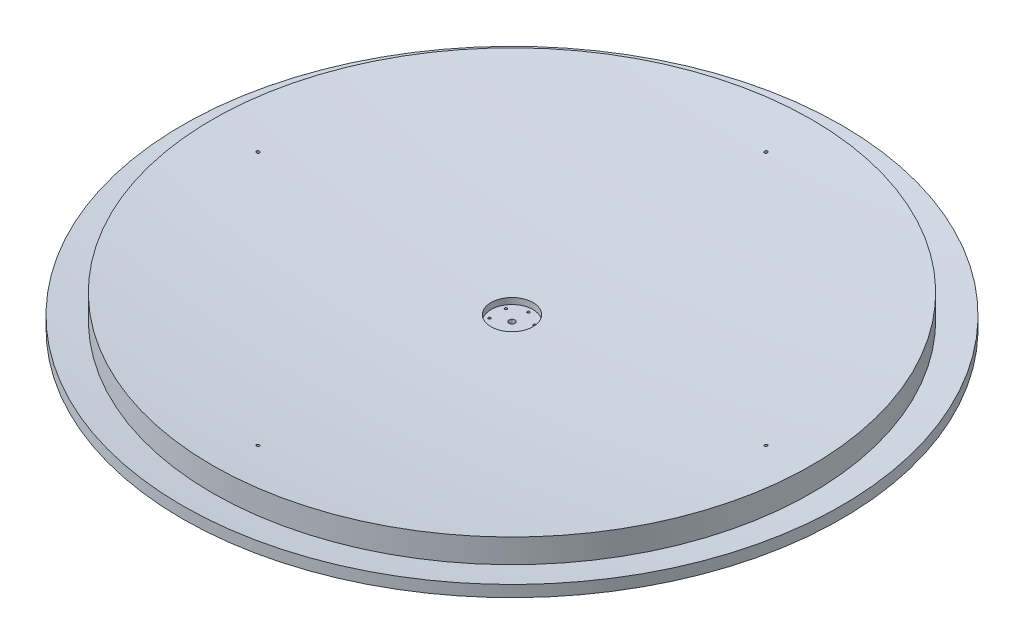
from build123d import *

# Parameters (mm, degrees)
HOLE_WIZARD_M51_D               = 4.2
HOLE_WIZARD_M52_D               = 4.2
HOLE_WIZARD_M52_DEPTH           = 4.7381927
HOLE_WIZARD_M52_TIP             = 1.2618073
HOLE_WIZARD_M2_51_D             = 2.05
HOLE_WIZARD_M2_51_DEPTH         = 5
HOLE_WIZARD_M2_51_TIP           = 0.615882135
HOLE_WIZARD_M61_D               = 5
HOLE_WIZARD_M61_DEPTH           = 11
HOLE_WIZARD_M61_TIP             = 1.502151548
HOLE_WIZARD_M61_ON_FACE_2_D     = 5
HOLE_WIZARD_M61_ON_FACE_2_DEPTH = 11
HOLE_WIZARD_M61_ON_FACE_2_TIP   = 1.502151548
HOLE_WIZARD_M61_ON_FACE_3_D     = 5
HOLE_WIZARD_M61_ON_FACE_3_DEPTH = 11
HOLE_WIZARD_M61_ON_FACE_3_TIP   = 1.502151548
HOLE_WIZARD_M61_ON_FACE_4_D     = 5
HOLE_WIZARD_M61_ON_FACE_4_DEPTH = 11
HOLE_WIZARD_M61_ON_FACE_4_TIP   = 1.502151548


with BuildPart() as part:
    # Эскиз1 → Повернуть1 (revolve)
    with BuildSketch(Plane(origin=(0, 0, 0), x_dir=(0, 0, -1), z_dir=(1, 0, 0))):
        with BuildLine():
            Line((5, 0), (549.999999997, 0))
            Line((549.999999997, 0), (549.999999997, 19.073064686))
            add(Edge.make_bspline(
                [(500, 12.300564646), (524.999999998, 15.525564666), (549.999999997, 19.073064686)],
                knots=[0.083339979, 0.083339979, 0.083339979, 0.916739775, 0.916739775, 0.916739775], degree=2))
            Line((500, 12.300564646), (500, 52.300564646))
            add(Edge.make_bspline(
                [(34.999709859, 20.212795007), (267.499728801, 22.310167332), (500, 52.300564646)],
                knots=[0.083373277, 0.083373277, 0.083373277, 0.917106042, 0.917106042, 0.917106042], degree=2))
            Line((34.999709859, 20.212795007), (34.999709859, 10))
            Line((34.999709859, 10), (5, 10))
            Line((5, 10), (5, 0))
        make_face()
    revolve(axis=Axis((0, -21.80583565, 0), (0, 1, 0)))

    # Отверстие обработанное метчиком M51 (through all)
    with Locations(Plane(origin=(0, 10, 0), x_dir=(1, 0, 0), z_dir=(0, 1, 0))):
        with Locations((-23.815698604, 13.75), (0, 27.5), (23.815698604, 13.75), (23.815698604, -13.75), (-0.186300957, -27.499368937), (-23.815698604, -13.75)):
            Hole(HOLE_WIZARD_M51_D / 2)

    # Отверстие обработанное метчиком M52
    with Locations(Plane(origin=(0, 0, 0), x_dir=(-1, 0, 0), z_dir=(0, -1, 0))):
        with Locations((0, -450), (264.503363532, -364.057647469), (427.975432333, -139.057647469), (427.975432333, 139.057647469), (264.503363532, 364.057647469), (0, 450), (-264.503363532, 364.057647469), (-427.975432333, 139.057647469), (-427.975432333, -139.057647469), (-264.503363532, -364.057647469)):
            Hole(HOLE_WIZARD_M52_D / 2, depth=HOLE_WIZARD_M52_DEPTH)
            with Locations((0, 0, -(HOLE_WIZARD_M52_DEPTH + HOLE_WIZARD_M52_TIP / 2))):  # 118° drill point
                Cone(0, HOLE_WIZARD_M52_D / 2, HOLE_WIZARD_M52_TIP, mode=Mode.SUBTRACT)

    # Отверстие обработанное метчиком M2.51
    with Locations(Plane(origin=(0, 0, 0), x_dir=(-1, 0, 0), z_dir=(0, -1, 0))):
        with Locations((10, -10), (-10, -10), (-10, 10), (10, 10)):
            Hole(HOLE_WIZARD_M2_51_D / 2, depth=HOLE_WIZARD_M2_51_DEPTH)
            with Locations((0, 0, -(HOLE_WIZARD_M2_51_DEPTH + HOLE_WIZARD_M2_51_TIP / 2))):  # 118° drill point
                Cone(0, HOLE_WIZARD_M2_51_D / 2, HOLE_WIZARD_M2_51_TIP, mode=Mode.SUBTRACT)

    # Отверстие обработанное метчиком M61
    with Locations(Plane(origin=(0, 43.242364935, 424), x_dir=(0, 0.10873432129, 0.994070846255), z_dir=(0, 0.994070846255, -0.10873432129))):
        with Locations((0, 0)):
            Hole(HOLE_WIZARD_M61_D / 2, depth=HOLE_WIZARD_M61_DEPTH)
            with Locations((0, 0, -(HOLE_WIZARD_M61_DEPTH + HOLE_WIZARD_M61_TIP / 2))):  # 118° drill point
                Cone(0, HOLE_WIZARD_M61_D / 2, HOLE_WIZARD_M61_TIP, mode=Mode.SUBTRACT)

    # Отверстие обработанное метчиком M61 on face 2
    with Locations(Plane(origin=(0, 43.242364935, -424), x_dir=(0, -0.10873398718, 0.994070882801), z_dir=(0, 0.994070882801, 0.10873398718))):
        with Locations((0, 0)):
            Hole(HOLE_WIZARD_M61_ON_FACE_2_D / 2, depth=HOLE_WIZARD_M61_ON_FACE_2_DEPTH)
            with Locations((0, 0, -(HOLE_WIZARD_M61_ON_FACE_2_DEPTH + HOLE_WIZARD_M61_ON_FACE_2_TIP / 2))):  # 118° drill point
                Cone(0, HOLE_WIZARD_M61_ON_FACE_2_D / 2, HOLE_WIZARD_M61_ON_FACE_2_TIP, mode=Mode.SUBTRACT)

    # Отверстие обработанное метчиком M61 on face 3
    with Locations(Plane(origin=(-424, 43.242364935, 0), x_dir=(0.994070882801, -0.10873398718, 0), z_dir=(0.10873398718, 0.994070882801, 0))):
        with Locations((0, 0)):
            Hole(HOLE_WIZARD_M61_ON_FACE_3_D / 2, depth=HOLE_WIZARD_M61_ON_FACE_3_DEPTH)
            with Locations((0, 0, -(HOLE_WIZARD_M61_ON_FACE_3_DEPTH + HOLE_WIZARD_M61_ON_FACE_3_TIP / 2))):  # 118° drill point
                Cone(0, HOLE_WIZARD_M61_ON_FACE_3_D / 2, HOLE_WIZARD_M61_ON_FACE_3_TIP, mode=Mode.SUBTRACT)

    # Отверстие обработанное метчиком M61 on face 4
    with Locations(Plane(origin=(424, 43.242364935, 0), x_dir=(0.994070882801, 0.10873398718, 0), z_dir=(-0.10873398718, 0.994070882801, 0))):
        with Locations((0, 0)):
            Hole(HOLE_WIZARD_M61_ON_FACE_4_D / 2, depth=HOLE_WIZARD_M61_ON_FACE_4_DEPTH)
            with Locations((0, 0, -(HOLE_WIZARD_M61_ON_FACE_4_DEPTH + HOLE_WIZARD_M61_ON_FACE_4_TIP / 2))):  # 118° drill point
                Cone(0, HOLE_WIZARD_M61_ON_FACE_4_D / 2, HOLE_WIZARD_M61_ON_FACE_4_TIP, mode=Mode.SUBTRACT)


solid = part.part
